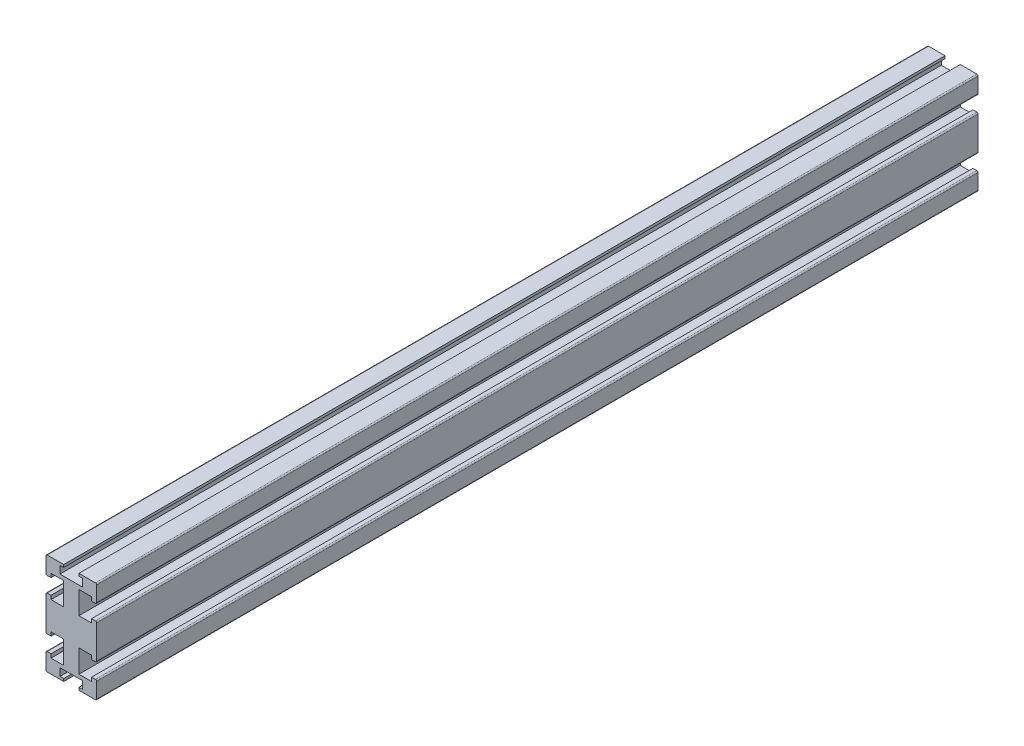
from build123d import *

# Parameters (mm, degrees)
EXTRUDE_1_DEPTH = 348
FILLET_1_R      = 0.5


with BuildPart() as part:
    # 草圖1 → 填料-伸長1 (new body)
    with BuildSketch(Plane.XY):
        Polygon((-4.5, 4), (4.5, 4), (4.5, 1), (3, 1), (3, 0), (10, 0), (10, 7), (8, 7), (8, 5.5), (3, 5.5), (3, 14.5), (8, 14.5), (8, 13), (10, 13), (10, 27), (8, 27), (8, 25.5), (3, 25.5), (3, 34.5), (8, 34.5), (8, 33), (10, 33), (10, 40), (3, 40), (3, 39), (4.5, 39), (4.5, 36), (-4.5, 36), (-4.5, 39), (-3, 39), (-3, 40), (-10, 40), (-10, 33), (-8, 33), (-8, 34.5), (-3, 34.5), (-3, 25.5), (-8, 25.5), (-8, 27), (-10, 27), (-10, 13), (-8, 13), (-8, 14.5), (-3, 14.5), (-3, 5.5), (-8, 5.5), (-8, 7), (-10, 7), (-10, 0), (-3, 0), (-3, 1), (-4.5, 1), align=None)
    extrude(amount=EXTRUDE_1_DEPTH)

    # 圓角1
    fillet_1_edges = [part.edges().sort_by_distance(p)[0] for p in [
        (-10, 0, 174),
        (-10, 7, 174),
        (-10, 13, 174),
        (-10, 27, 174),
        (-10, 33, 174),
        (-10, 40, 174),
        (10, 40, 174),
        (10, 33, 174),
        (10, 27, 174),
        (10, 13, 174),
        (10, 7, 174),
        (10, 0, 174),
    ]]
    fillet(fillet_1_edges, radius=FILLET_1_R)


solid = part.part
